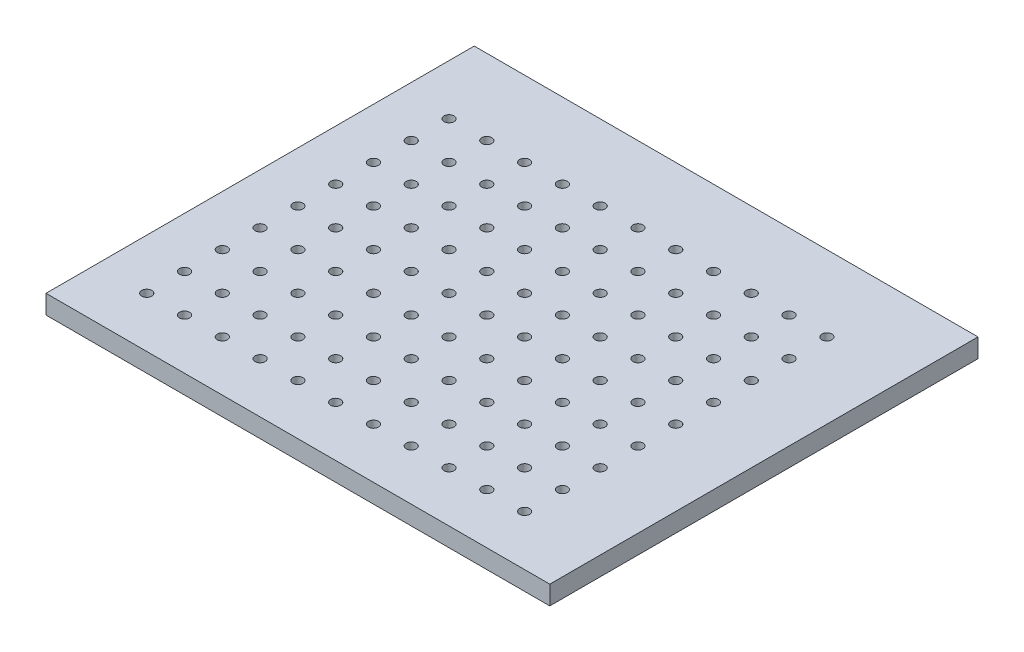
from build123d import *

# Parameters (mm, degrees)
ESBO_O1_W                 = 400
ESBO_O1_H                 = 340
RESSALTO_EXTRUS_O1_DEPTH  = 15
ESBO_O2_R                 = 4
CORTE_EXTRUS_O1_DEPTH     = 263.916336503
PADR_O_LINEAR1_COUNT      = 11
PADR_O_LINEAR1_PITCH      = 30
PADR_O_LINEAR1_COUNT_DIR2 = 9
PADR_O_LINEAR1_PITCH_DIR2 = 30


with BuildPart() as part:
    # Esboço1 → Ressalto-extrusão1 (new body)
    with BuildSketch(Plane(origin=(0, 0, 0), x_dir=(1, 0, 0), z_dir=(0, 1, 0))):
        Rectangle(ESBO_O1_W, ESBO_O1_H)
    extrude(amount=RESSALTO_EXTRUS_O1_DEPTH)

    # Esboço2 → Corte-extrusão1 (cut, through all)
    with BuildSketch(Plane(origin=(0, 15, 0), x_dir=(1, 0, 0), z_dir=(0, 1, 0))):
        with Locations(Location((-160, -130, 0), (0, 0, 270))):
            Circle(ESBO_O2_R)
    corte_extrus_o1 = extrude(amount=-CORTE_EXTRUS_O1_DEPTH, mode=Mode.SUBTRACT)

    # Padrão linear1: Corte-extrus_o1 11 × 9
    with Locations(*[(i * PADR_O_LINEAR1_PITCH, 0, -j * PADR_O_LINEAR1_PITCH_DIR2) for i in range(PADR_O_LINEAR1_COUNT) for j in range(PADR_O_LINEAR1_COUNT_DIR2) if (i, j) != (0, 0)]):
        add(corte_extrus_o1, mode=Mode.SUBTRACT)


solid = part.part
